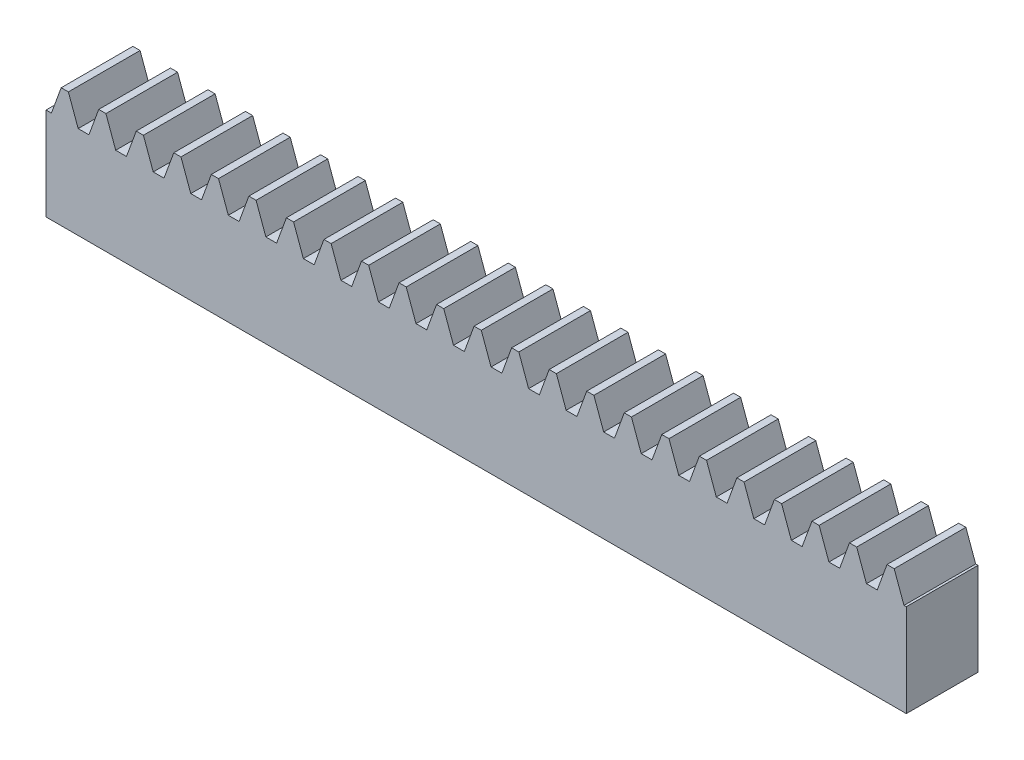
from build123d import *

# Parameters (mm, degrees)
BLANKSKE_W        = 304.8
BLANKSKE_H        = 42.333333333
BLANK_DEPTH       = 25.4
TOOTHCUTSIM_DEPTH = 309.772264155
TEETHCUTS_COUNT   = 24
TEETHCUTS_PITCH   = 13.299408885


with BuildPart() as part:
    # BlankSke → Blank (new body)
    with BuildSketch(Plane.XY):
        with Locations((152.4, 21.166666667)):
            Rectangle(BLANKSKE_W, BLANKSKE_H)
    extrude(amount=-BLANK_DEPTH)

    # TooCutSkeSim → ToothCutSim (cut, through all)
    with BuildSketch(Plane.XY):
        Polygon((1.909383065, 32.808333333), (-1.909383065, 32.808333333), (-5.38544439, 42.358733333), (5.38544439, 42.358733333), align=None)
    toothcutsim = extrude(amount=-TOOTHCUTSIM_DEPTH, mode=Mode.SUBTRACT)

    # TeethCuts: ToothCutSim ×24
    with Locations(*[(i * TEETHCUTS_PITCH, 0, 0) for i in range(1, TEETHCUTS_COUNT)]):
        add(toothcutsim, mode=Mode.SUBTRACT)


solid = part.part
